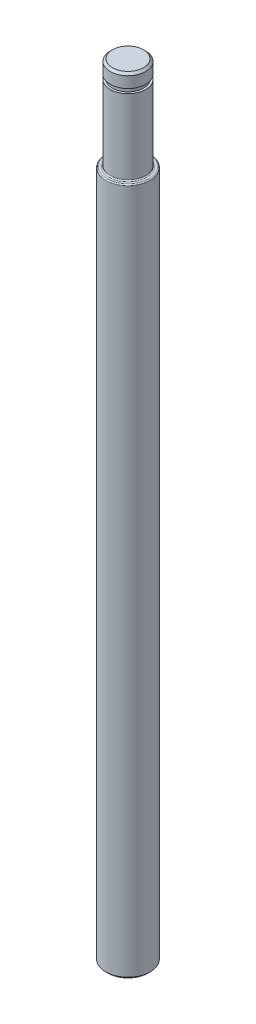
from build123d import *

# Parameters (mm, degrees)
RESSALTO_EXTRUS_O1_DEPTH      = 94
RESSALTO_EXTRUS_O1_DEPTH_BACK = 82
ESBO_O1_R                     = 5
ESBO_O2_R                     = 14
ESBO_O2_R_2                   = 4
CORTE_EXTRUS_O1_DEPTH         = 21
CHANFRO1_SIZE                 = 0.5
FILETE1_R                     = 0.25
CHANFRO2_SIZE                 = 0.5
CORTE_EXTRUS_O2_START         = -3
ESBO_O3_R                     = 13.5
ESBO_O3_R_2                   = 3.5
CORTE_EXTRUS_O2_DEPTH         = 1


with BuildPart() as part:
    # Esboço1 → Ressalto-extrusão1 (new, two sides: drawn at the far end of the back side and taken through both)
    with BuildSketch(Plane(origin=(0, 0, 0), x_dir=(1, 0, 0), z_dir=(0, 1, 0)).offset(-RESSALTO_EXTRUS_O1_DEPTH_BACK)):
        with Locations(Location((0, 0, 0), (0, 0, 270))):
            Circle(ESBO_O1_R)
    extrude(amount=RESSALTO_EXTRUS_O1_DEPTH + RESSALTO_EXTRUS_O1_DEPTH_BACK)

    # Esboço2 → Corte-extrusão1 (cut)
    with BuildSketch(Plane(origin=(0, 94, 0), x_dir=(1, 0, 0), z_dir=(0, 1, 0))):
        Circle(ESBO_O2_R)
        with Locations(Location((0, 0, 0), (0, 0, 270))):
            Circle(ESBO_O2_R_2, mode=Mode.SUBTRACT)
    extrude(amount=-CORTE_EXTRUS_O1_DEPTH, mode=Mode.SUBTRACT)

    # Chanfro1
    chanfro1_edges = [part.edges().sort_by_distance(p)[0] for p in [
        (0, 94, -4),
    ]]
    chamfer(chanfro1_edges, length=CHANFRO1_SIZE)

    # Filete1
    filete1_edges = [part.edges().sort_by_distance(p)[0] for p in [
        (0, 73, -5),
        (0, 73, -4),
    ]]
    fillet(filete1_edges, radius=FILETE1_R)

    # Chanfro2
    chanfro2_edges = [part.edges().sort_by_distance(p)[0] for p in [
        (0, -82, -5),
    ]]
    chamfer(chanfro2_edges, length=CHANFRO2_SIZE)

    # Esboço3 → Corte-extrusão2 (cut)
    with BuildSketch(Plane(origin=(0, 94, 0), x_dir=(1, 0, 0), z_dir=(0, 1, 0)).offset(CORTE_EXTRUS_O2_START)):
        Circle(ESBO_O3_R)
        with Locations(Location((0, 0, 0), (0, 0, 270))):
            Circle(ESBO_O3_R_2, mode=Mode.SUBTRACT)
    extrude(amount=-CORTE_EXTRUS_O2_DEPTH, mode=Mode.SUBTRACT)


solid = part.part
